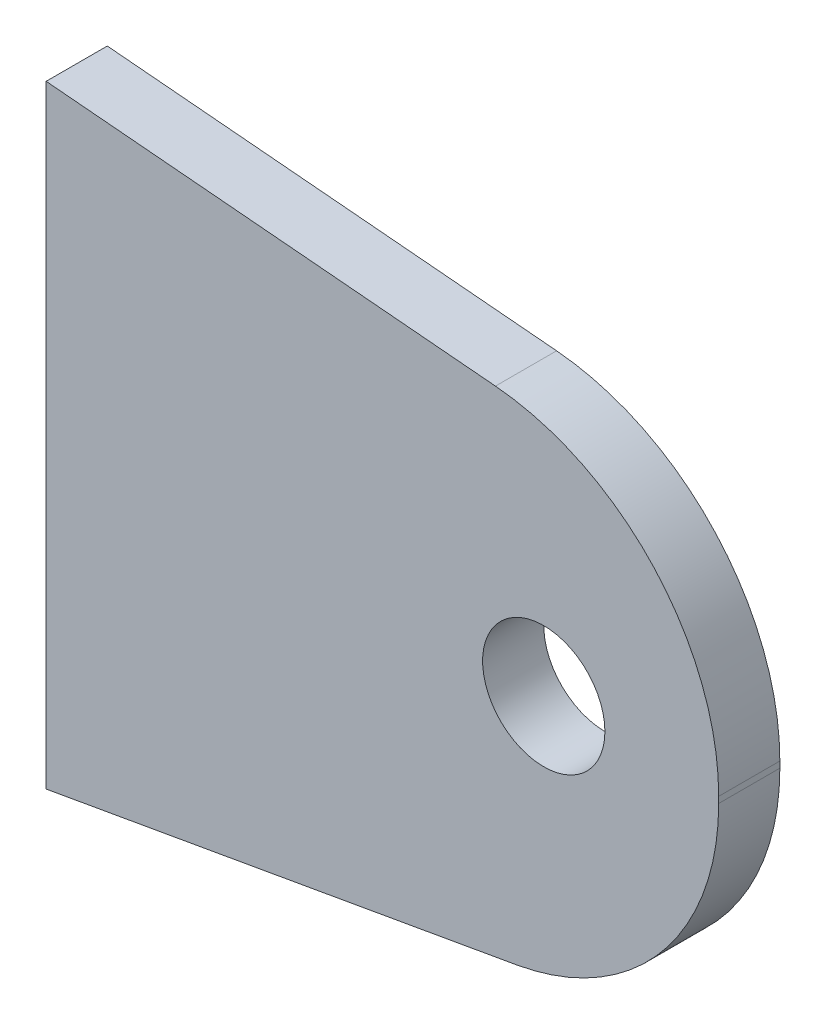
from build123d import *

# Parameters (mm, degrees)
SKETCH1_W                       = 66.08808118
SKETCH1_H                       = 37.717352964
BOSS_EXTRUDE1_DEPTH             = 3.175
F_1_4_0_25_DIAMETER_HOLE1_D     = 6.35
F_1_4_0_25_DIAMETER_HOLE1_DEPTH = 9.268267535
F_1_4_0_25_DIAMETER_HOLE1_TIP   = 1.907732465
CUT_EXTRUDE1_DEPTH              = 43.378010118
FILLET1_R                       = 12.7


with BuildPart() as part:
    # Sketch1 → Boss-Extrude1 (new body)
    with BuildSketch(Plane.XY):
        with Locations((3.763463947, 1.902410347)):
            Rectangle(SKETCH1_W, SKETCH1_H)
    extrude(amount=BOSS_EXTRUDE1_DEPTH)

    # 1/4 (0.25) Diameter Hole1
    with Locations(Plane.XY.offset(3.175)):
        with Locations((-3.439886643, 6.028832829)):
            Hole(F_1_4_0_25_DIAMETER_HOLE1_D / 2, depth=F_1_4_0_25_DIAMETER_HOLE1_DEPTH)
            with Locations((0, 0, -(F_1_4_0_25_DIAMETER_HOLE1_DEPTH + F_1_4_0_25_DIAMETER_HOLE1_TIP / 2))):  # 118° drill point
                Cone(0, F_1_4_0_25_DIAMETER_HOLE1_D / 2, F_1_4_0_25_DIAMETER_HOLE1_TIP, mode=Mode.SUBTRACT)

    # Sketch4 → Cut-Extrude1 (cut, through all)
    with BuildSketch(Plane(origin=(0, 0, 0), x_dir=(-1, 0, 0), z_dir=(0, 0, -1))):
        Polygon((-5.644423357, 17.705545255), (29.280576643, 20.761086829), (-36.807504537, 20.761086829), (-36.807504537, -16.956266135), (29.280576643, -16.956266135), (29.280576643, -11.068161171), (-5.644423357, -4.90994137), align=None)
    extrude(amount=-CUT_EXTRUDE1_DEPTH, mode=Mode.SUBTRACT)

    # Fillet1
    fillet1_edges = [part.edges().sort_by_distance(p)[0] for p in [
        (5.644423357, 17.705545255, 1.5875),
        (5.644423357, -4.90994137, 1.5875),
    ]]
    fillet(fillet1_edges, radius=FILLET1_R)


solid = part.part
